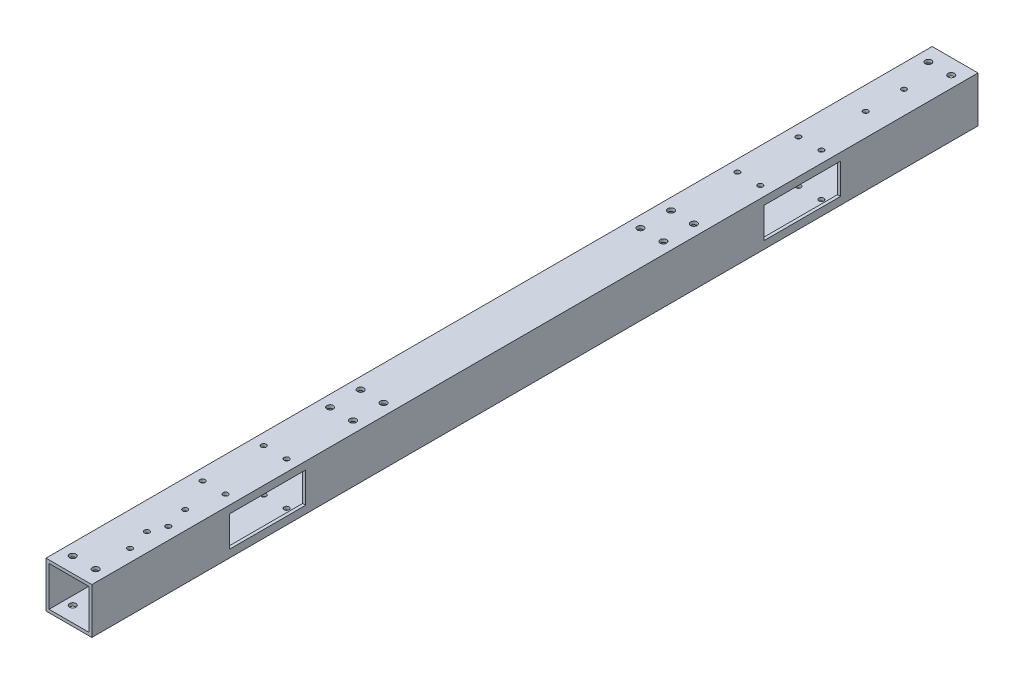
from build123d import *

# Parameters (mm, degrees)
SKETCH_1_W          = 30
SKETCH_1_H          = 30
SKETCH_1_W_2        = 26
SKETCH_1_H_2        = 26
EXTRUDE_1_DEPTH     = 580
SKETCH_2_W          = 50
SKETCH_2_H          = 20
CUT_EXTRUDE_1_DEPTH = 581.969018107
SKETCH_3_R          = 2.1
CUT_EXTRUDE_2_DEPTH = 581.969018107
SKETCH_4_R          = 2.1
CUT_EXTRUDE_3_DEPTH = 581.969018107
SKETCH_7_R          = 1.65
CUT_EXTRUDE_6_DEPTH = 581.969018107
SKETCH_8_R          = 1.65
CUT_EXTRUDE_7_DEPTH = 581.969018107
SKETCH_9_R          = 1.65
CUT_EXTRUDE_8_DEPTH = 581.969018107


with BuildPart() as part:
    # 草图1 → 凸台-拉伸1 (new body)
    with BuildSketch(Plane.XY):
        Rectangle(SKETCH_1_W, SKETCH_1_H)
        Rectangle(SKETCH_1_W_2, SKETCH_1_H_2, mode=Mode.SUBTRACT)
    extrude(amount=EXTRUDE_1_DEPTH)

    # 草图2 → 切除-拉伸1 (cut, through all)
    with BuildSketch(Plane.ZY.offset(15)):
        with Locations((115, 0)):
            Rectangle(SKETCH_2_W, SKETCH_2_H)
        with Locations((465, 0)):
            Rectangle(SKETCH_2_W, SKETCH_2_H)
    extrude(amount=-CUT_EXTRUDE_1_DEPTH, mode=Mode.SUBTRACT)

    # 草图3 → 切除-拉伸2 (cut, through all)
    with BuildSketch(Plane(origin=(0, 15, 0), x_dir=(1, 0, 0), z_dir=(0, 1, 0))):
        with Locations(Location((7.5, -10, 0), (0, 0, 270))):
            Circle(SKETCH_3_R)
        with Locations(Location((-7.5, -10, 0), (0, 0, 270))):
            Circle(SKETCH_3_R)
        with Locations(Location((-7.5, -570, 0), (0, 0, 270))):
            Circle(SKETCH_3_R)
        with Locations(Location((7.5, -570, 0), (0, 0, 270))):
            Circle(SKETCH_3_R)
    extrude(amount=-CUT_EXTRUDE_2_DEPTH, mode=Mode.SUBTRACT)

    # 草图4 → 切除-拉伸3 (cut, through all)
    with BuildSketch(Plane(origin=(0, 15, 0), x_dir=(1, 0, 0), z_dir=(0, 1, 0))):
        with Locations(Location((7.5, -401.567476668, 0), (0, 0, 270))):
            Circle(SKETCH_4_R)
        with Locations(Location((-7.5, -401.567476668, 0), (0, 0, 270))):
            Circle(SKETCH_4_R)
        with Locations(Location((-7.5, -381.567476668, 0), (0, 0, 270))):
            Circle(SKETCH_4_R)
        with Locations(Location((7.5, -381.567476668, 0), (0, 0, 270))):
            Circle(SKETCH_4_R)
        with Locations(Location((7.5, -178.432523332, 0), (0, 0, 270))):
            Circle(SKETCH_4_R)
        with Locations(Location((-7.5, -178.432523332, 0), (0, 0, 270))):
            Circle(SKETCH_4_R)
        with Locations(Location((-7.5, -198.432523332, 0), (0, 0, 270))):
            Circle(SKETCH_4_R)
        with Locations(Location((7.5, -198.432523332, 0), (0, 0, 270))):
            Circle(SKETCH_4_R)
        with Locations((162.5, -178.432523332)):
            Circle(SKETCH_4_R)
        with Locations((177.5, -178.432523332)):
            Circle(SKETCH_4_R)
        with Locations((177.5, -198.432523332)):
            Circle(SKETCH_4_R)
        with Locations((162.5, -198.432523332)):
            Circle(SKETCH_4_R)
        with Locations((162.5, -381.567476668)):
            Circle(SKETCH_4_R)
        with Locations((162.5, -401.567476668)):
            Circle(SKETCH_4_R)
        with Locations((177.5, -401.567476668)):
            Circle(SKETCH_4_R)
        with Locations((177.5, -381.567476668)):
            Circle(SKETCH_4_R)
    extrude(amount=-CUT_EXTRUDE_3_DEPTH, mode=Mode.SUBTRACT)

    # 草图7 → 切除-拉伸6 (cut, through all)
    with BuildSketch(Plane(origin=(0, 15, 0), x_dir=(1, 0, 0), z_dir=(0, 1, 0))):
        with Locations(Location((0, -33.5, 0), (0, 0, 270))):
            Circle(SKETCH_7_R)
        with Locations(Location((0, -58.5, 0), (0, 0, 270))):
            Circle(SKETCH_7_R)
        with Locations((167, -73.072466057)):
            Circle(SKETCH_7_R)
        with Locations((167, -48.072466057)):
            Circle(SKETCH_7_R)
    extrude(amount=-CUT_EXTRUDE_6_DEPTH, mode=Mode.SUBTRACT)

    # 草图8 → 切除-拉伸7 (cut, through all)
    with BuildSketch(Plane(origin=(0, 15, 0), x_dir=(1, 0, 0), z_dir=(0, 1, 0))):
        with Locations(Location((3, -506.927533943, 0), (0, 0, 270))):
            Circle(SKETCH_8_R)
        with Locations(Location((7, -521.975679885, 0), (0, 0, 270))):
            Circle(SKETCH_8_R)
        with Locations(Location((3, -531.927533943, 0), (0, 0, 270))):
            Circle(SKETCH_8_R)
        with Locations(Location((7, -546.975679885, 0), (0, 0, 270))):
            Circle(SKETCH_8_R)
    extrude(amount=-CUT_EXTRUDE_7_DEPTH, mode=Mode.SUBTRACT)

    # 草图9 → 切除-拉伸8 (cut, through all)
    with BuildSketch(Plane(origin=(0, 15, 0), x_dir=(1, 0, 0), z_dir=(0, 1, 0))):
        with Locations(Location((-7.5, -445, 0), (0, 0, 270))):
            Circle(SKETCH_9_R)
        with Locations(Location((7.5, -445, 0), (0, 0, 270))):
            Circle(SKETCH_9_R)
        with Locations(Location((7.5, -485, 0), (0, 0, 270))):
            Circle(SKETCH_9_R)
        with Locations(Location((-7.5, -485, 0), (0, 0, 270))):
            Circle(SKETCH_9_R)
        with Locations(Location((-7.5, -95, 0), (0, 0, 270))):
            Circle(SKETCH_9_R)
        with Locations(Location((7.5, -95, 0), (0, 0, 270))):
            Circle(SKETCH_9_R)
        with Locations(Location((-7.5, -135, 0), (0, 0, 270))):
            Circle(SKETCH_9_R)
        with Locations(Location((7.5, -135, 0), (0, 0, 270))):
            Circle(SKETCH_9_R)
    extrude(amount=-CUT_EXTRUDE_8_DEPTH, mode=Mode.SUBTRACT)


solid = part.part
